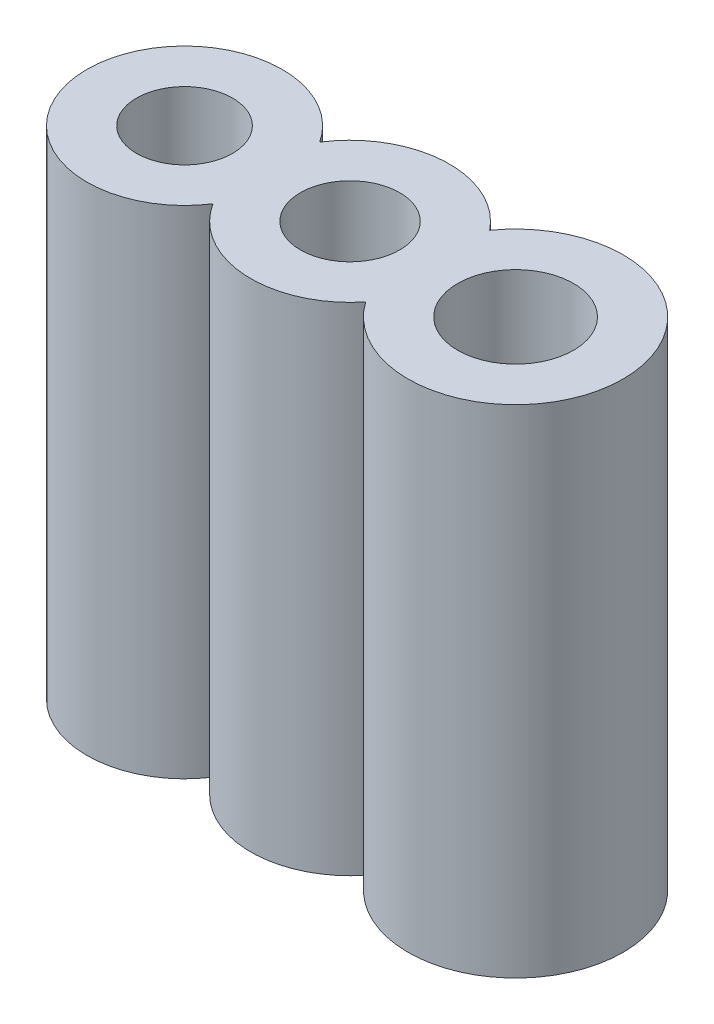
from build123d import *

# Parameters (mm, degrees)
SKETCH1_R           = 1.5
SKETCH1_R_2         = 1.75
SKETCH1_R_3         = 1.45
BOSS_EXTRUDE1_DEPTH = 15


with BuildPart() as part:
    # Sketch1 → Boss-Extrude1 (new body)
    with BuildSketch(Plane(origin=(0, 0, 0), x_dir=(1, 0, 0), z_dir=(0, 1, 0))):
        with BuildLine():
            ThreePointArc((-2.52975, 1.612564708), (-7.95, 0), (-2.52975, -1.612564708))
            ThreePointArc((-2.52975, -1.612564708), (-0.159877177, -2.995736852), (2.34375, -1.872654783))
            ThreePointArc((2.34375, -1.872654783), (8.25, 0), (2.34375, 1.872654783))
            ThreePointArc((2.34375, 1.872654783), (-0.159877177, 2.995736852), (-2.52975, 1.612564708))
        make_face()
        with Locations(Location((0, 0, 0), (0, 0, 270))):
            Circle(SKETCH1_R, mode=Mode.SUBTRACT)
        with Locations(Location((5, 0, 0), (0, 0, 270))):
            Circle(SKETCH1_R_2, mode=Mode.SUBTRACT)
        with Locations(Location((-5, 0, 0), (0, 0, 270))):
            Circle(SKETCH1_R_3, mode=Mode.SUBTRACT)
    extrude(amount=BOSS_EXTRUDE1_DEPTH)


solid = part.part
